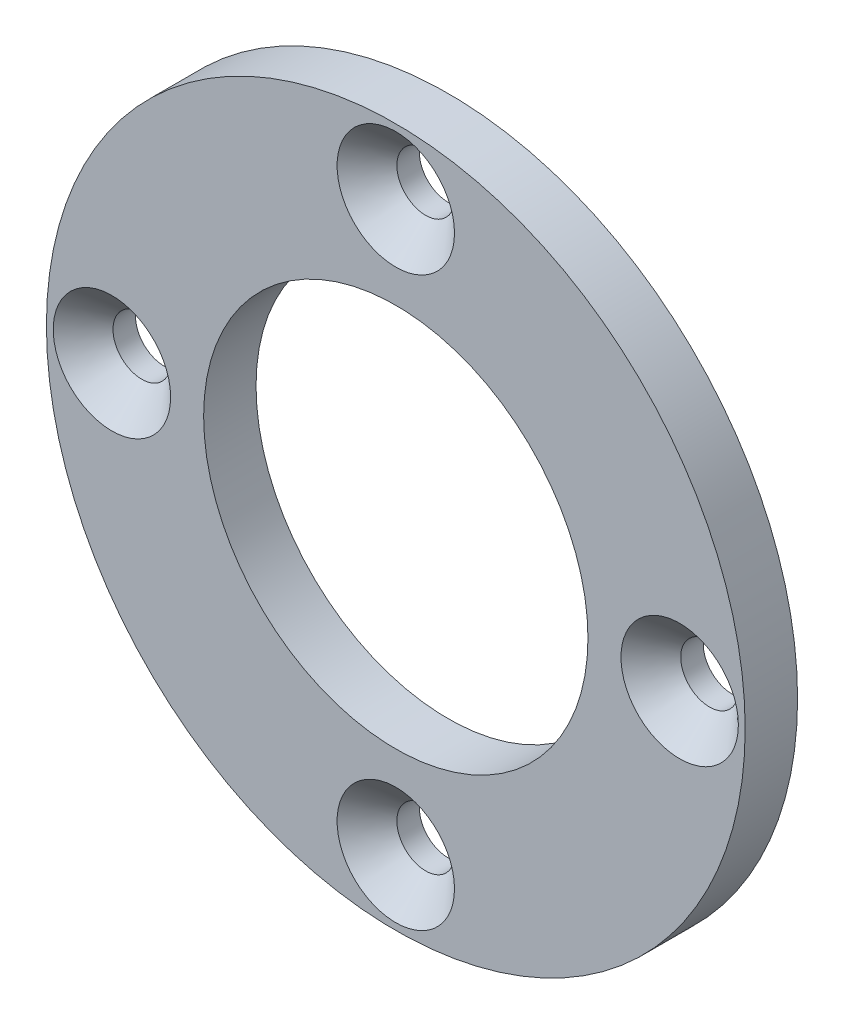
from build123d import *

# Parameters (mm, degrees)
SKETCH1_R                                    = 40
SKETCH1_R_2                                  = 22
BOSS_EXTRUDE1_DEPTH                          = 6
CSK_FOR_M5_COUNTERSUNK_FLAT_HEAD_SCR_2_COUNT = 2
CSK_FOR_M5_COUNTERSUNK_FLAT_HEAD_SCR_2_PITCH = 45.961940777
CSK_FOR_M5_COUNTERSUNK_FLAT_HEAD_SCR_3_COUNT = 2
CSK_FOR_M5_COUNTERSUNK_FLAT_HEAD_SCR_3_PITCH = 65
CSK_FOR_M5_COUNTERSUNK_FLAT_HEAD_SCR_4_COUNT = 2
CSK_FOR_M5_COUNTERSUNK_FLAT_HEAD_SCR_4_PITCH = 45.961940777


with BuildPart() as part:
    # Sketch1 → Boss-Extrude1 (new body)
    with BuildSketch(Plane.XY):
        Circle(SKETCH1_R)
        Circle(SKETCH1_R_2, mode=Mode.SUBTRACT)
    extrude(amount=BOSS_EXTRUDE1_DEPTH)

    # Sketch6 → CSK for M5 Countersunk Flat Head Screw1 (revolve, cut)
    with BuildSketch(Plane(origin=(0, 32.5, 6), x_dir=(0, -1, 0), z_dir=(1, 0, 0))):
        Polygon((0, 0), (0, 6), (3.3, 6), (3.3, 3.42), (6.72, 0), align=None)
    csk_for_m5_countersunk_flat_head_screw1 = revolve(axis=Axis((0, 32.5, 12.35), (0, 0, -1)), mode=Mode.SUBTRACT)

    # CSK for M5 Countersunk Flat Head Scr 2: CSK for M5 Countersunk Flat Head Screw1 ×2
    with Locations(*[Vector(-0.7071067811865476, -0.7071067811865476, 0) * (i * CSK_FOR_M5_COUNTERSUNK_FLAT_HEAD_SCR_2_PITCH) for i in range(1, CSK_FOR_M5_COUNTERSUNK_FLAT_HEAD_SCR_2_COUNT)]):
        add(csk_for_m5_countersunk_flat_head_screw1, mode=Mode.SUBTRACT)

    # CSK for M5 Countersunk Flat Head Scr 3: CSK for M5 Countersunk Flat Head Screw1 ×2
    with Locations(*[(0, -i * CSK_FOR_M5_COUNTERSUNK_FLAT_HEAD_SCR_3_PITCH, 0) for i in range(1, CSK_FOR_M5_COUNTERSUNK_FLAT_HEAD_SCR_3_COUNT)]):
        add(csk_for_m5_countersunk_flat_head_screw1, mode=Mode.SUBTRACT)

    # CSK for M5 Countersunk Flat Head Scr 4: CSK for M5 Countersunk Flat Head Screw1 ×2
    with Locations(*[Vector(0.7071067811865476, -0.7071067811865476, 0) * (i * CSK_FOR_M5_COUNTERSUNK_FLAT_HEAD_SCR_4_PITCH) for i in range(1, CSK_FOR_M5_COUNTERSUNK_FLAT_HEAD_SCR_4_COUNT)]):
        add(csk_for_m5_countersunk_flat_head_screw1, mode=Mode.SUBTRACT)


solid = part.part
